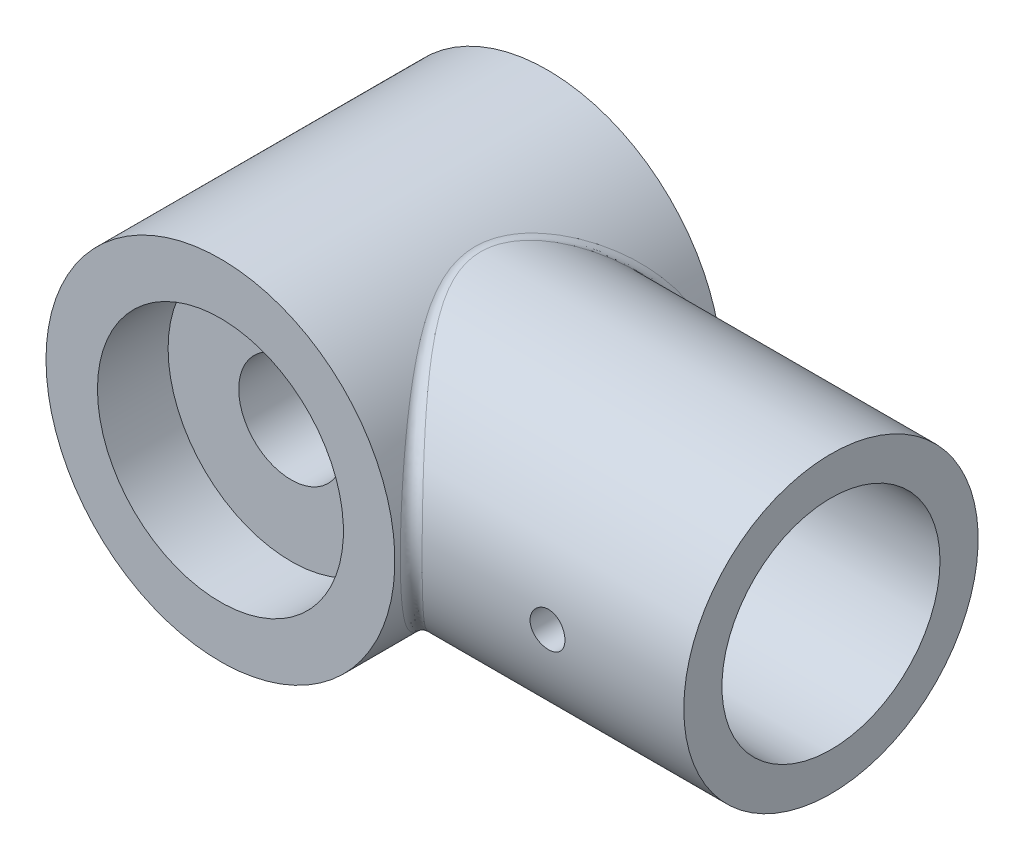
from build123d import *

# Parameters (mm, degrees)
SKETCH1_W                      = 16
SKETCH1_H                      = 30
SKETCH2_W                      = 32.412217981
SKETCH2_H                      = 13.5
F_20_0_20_DIAMETER_HOLE1_D     = 20
F_20_0_20_DIAMETER_HOLE1_DEPTH = 25
F_4_0_3_2_DIAMETER_HOLE1_D     = 3.2
F_4_0_3_2_DIAMETER_HOLE1_DEPTH = 5.202041075
FILLET1_R                      = 1
SCALE1_SCALE                   = 1.25
CUT_EXTRUDE1_DEPTH             = 63.995182355
CUT_EXTRUDE1_DEPTH_BACK        = 63.995182355
SKETCH8_R                      = 2


with BuildPart() as part:
    # Sketch1 → Revolve1 (revolve)
    with BuildSketch(Plane.XZ, mode=Mode.PRIVATE) as revolve1_sk:
        with Locations((8, 15)):
            Rectangle(SKETCH1_W, SKETCH1_H)
    revolve(revolve1_sk.sketch.rotate(Axis((0, 0, 30), (0, 0, -1)), 180), axis=Axis((0, 0, 30), (0, 0, -1)))

    # Sketch2 → Revolve2 (revolve)
    with BuildSketch(Plane(origin=(0, -4.254877545, 1.323753804), x_dir=(-1, 0, 0), z_dir=(0, 0.9548558773058256, -0.29706944234391125)), mode=Mode.PRIVATE) as revolve2_sk:
        with Locations((-24.79389101, 21.07283816)):
            Rectangle(SKETCH2_W, SKETCH2_H)
    revolve(revolve2_sk.sketch.rotate(Axis((41, 0, 15), (-1, 0, 0)), 342.718328232), axis=Axis((41, 0, 15), (-1, 0, 0)))

    # Sketch3 → Cut-Revolve1 (revolve, cut)
    with BuildSketch(Plane.XZ, mode=Mode.PRIVATE) as cut_revolve1_sk:
        Polygon((11.28, 30), (0, 30), (0, 0), (11.28, 0), (11.28, 6.48), (4.8, 6.48), (4.8, 23.52), (11.28, 23.52), align=None)
    revolve(cut_revolve1_sk.sketch.rotate(Axis((0, 0, 30), (0, 0, -1)), 180), axis=Axis((0, 0, 30), (0, 0, -1)), mode=Mode.SUBTRACT)

    # Ø20.0 (20) Diameter Hole1
    with Locations(Plane(origin=(41, 0, 0), x_dir=(0, 0, -1), z_dir=(1, 0, 0))):
        with Locations((-15, 0)):
            Hole(F_20_0_20_DIAMETER_HOLE1_D / 2, depth=F_20_0_20_DIAMETER_HOLE1_DEPTH)

    # Ø4.0 (3.2) Diameter Hole1
    with Locations(Plane.XY.offset(5.202041075)):
        with Locations((28.5, 0)):
            Hole(F_4_0_3_2_DIAMETER_HOLE1_D / 2, depth=F_4_0_3_2_DIAMETER_HOLE1_DEPTH)

    # Fillet1
    fillet1_edges = [part.edges().sort_by_distance(p)[0] for p in [
        (16, 0, 1.5),
    ]]
    fillet(fillet1_edges, radius=FILLET1_R)


with BuildPart() as part_1:
    # Scale1: scaled about (7.837990983, 1.846e-06, 15.013224445)
    add(part.part.scale(SCALE1_SCALE).moved(Location((-1.959497746, -4.61e-07, -3.753306111))))

    # Sketch8 → Cut-Extrude1 (cut, two sides: drawn at the far end of the back side and taken through both)
    with BuildSketch(Plane.XY.offset(-CUT_EXTRUDE1_DEPTH_BACK)):
        with Locations((33.665506366, 6.335e-06)):
            Circle(SKETCH8_R)
    extrude(amount=CUT_EXTRUDE1_DEPTH + CUT_EXTRUDE1_DEPTH_BACK, mode=Mode.SUBTRACT)


solid = part_1.part
